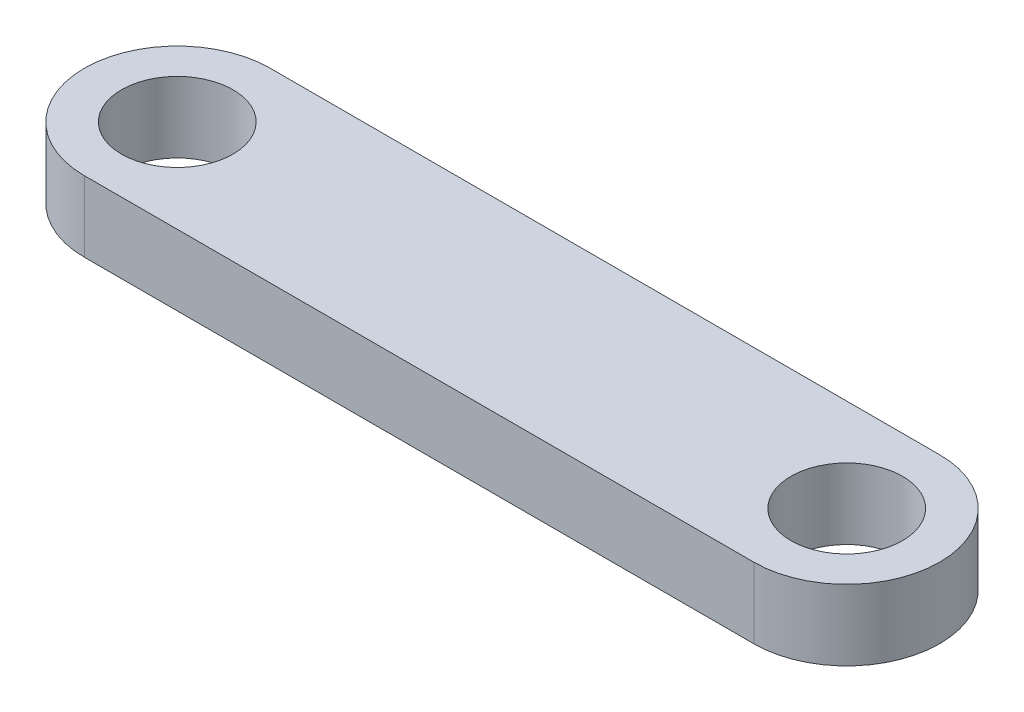
from build123d import *

# Parameters (mm, degrees)
BOSS_EXTRUDE1_DEPTH = 1.9
SKETCH2_R           = 1.5
CUT_EXTRUDE1_DEPTH  = 12.920989892


with BuildPart() as part:
    # Sketch1 → Boss-Extrude1 (new body)
    with BuildSketch(Plane(origin=(0, 0, 0), x_dir=(1, 0, 0), z_dir=(0, 1, 0))):
        with BuildLine():
            Line((9, -2.5), (-9, -2.5))
            ThreePointArc((-9, -2.5), (-11.5, 0), (-9, 2.5))
            Line((-9, 2.5), (9, 2.5))
            ThreePointArc((9, 2.5), (11.5, 0), (9, -2.5))
        make_face()
    extrude(amount=BOSS_EXTRUDE1_DEPTH)

    # Sketch2 → Cut-Extrude1 (cut, through all)
    with BuildSketch(Plane(origin=(0, 1.9, 0), x_dir=(1, 0, 0), z_dir=(0, 1, 0))):
        with Locations(Location((9, 0, 0), (0, 0, 270))):
            Circle(SKETCH2_R)
        with Locations(Location((-9, 0, 0), (0, 0, 270))):
            Circle(SKETCH2_R)
    extrude(amount=-CUT_EXTRUDE1_DEPTH, mode=Mode.SUBTRACT)


solid = part.part
